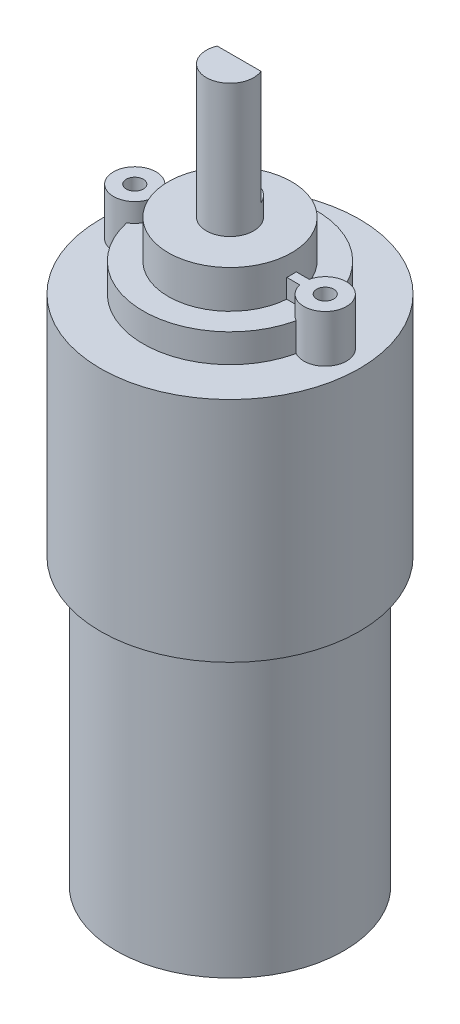
from build123d import *

# Parameters (mm, degrees)
CROQUIS1_W              = 2.5
CROQUIS1_H              = 14
CORTAR_EXTRUIR1_DEPTH   = 12
CROQUIS4_R              = 2.25
CROQUIS4_R_2            = 0.9
CROQUIS4_W              = 18
CROQUIS4_H              = 1
SALIENTE_EXTRUIR1_DEPTH = 5


with BuildPart() as part:
    # Croquis1 → Revolución1 (revolve)
    with BuildSketch(Plane.XY, mode=Mode.PRIVATE) as revoluci_n1_sk:
        with Locations((-1.25, 37.5)):
            Rectangle(CROQUIS1_W, CROQUIS1_H)
        Polygon((-12, -30.5), (0, -30.5), (0, 30.5), (-6.5, 30.5), (-6.5, 26.5), (-9.15, 26.5), (-9.15, 23.5), (-13.65, 23.5), (-13.65, -0.5), (-12, -0.5), align=None)
    revolve(revoluci_n1_sk.sketch.rotate(Axis((0, 65.687156563, 0), (0, -1, 0)), 270), axis=Axis((0, 65.687156563, 0), (0, -1, 0)))

    # Croquis2 → Cortar-Extruir1 (cut)
    with BuildSketch(Plane(origin=(0, 44.5, 0), x_dir=(1, 0, 0), z_dir=(0, 1, 0))):
        Polygon((-55.580517034, 0.96), (-2.308332732, 0.96), (2.308332732, 0.96), (55.580517034, 0.96), (55.580517034, 107.504368605), (-55.580517034, 107.504368605), align=None)
    extrude(amount=-CORTAR_EXTRUIR1_DEPTH, mode=Mode.SUBTRACT)

    # Croquis4 → Saliente-Extruir1 (add)
    # profile 1 of 3: a face of its own
    with BuildSketch(Plane(origin=(0, 23.5, 0), x_dir=(1, 0, 0), z_dir=(0, 1, 0))):
        with Locations((-10.04, 0)):
            Circle(CROQUIS4_R)
        with Locations(Location((-10.04, 0, 0), (0, 0, 8.158462719))):
            Circle(CROQUIS4_R_2, mode=Mode.SUBTRACT)
    # profile 2 of 3: a face of its own
    with BuildSketch(Plane(origin=(0, 23.5, 0), x_dir=(1, 0, 0), z_dir=(0, 1, 0))):
        with Locations((10.04, 0)):
            Circle(CROQUIS4_R)
        with Locations(Location((10.04, 0, 0), (0, 0, 171.841537281))):
            Circle(CROQUIS4_R_2, mode=Mode.SUBTRACT)
    # profile 3 of 3: a face of its own
    with BuildSketch(Plane(origin=(0, 23.5, 0), x_dir=(1, 0, 0), z_dir=(0, 1, 0))):
        Rectangle(CROQUIS4_W, CROQUIS4_H)
    extrude(amount=SALIENTE_EXTRUIR1_DEPTH)


solid = part.part
